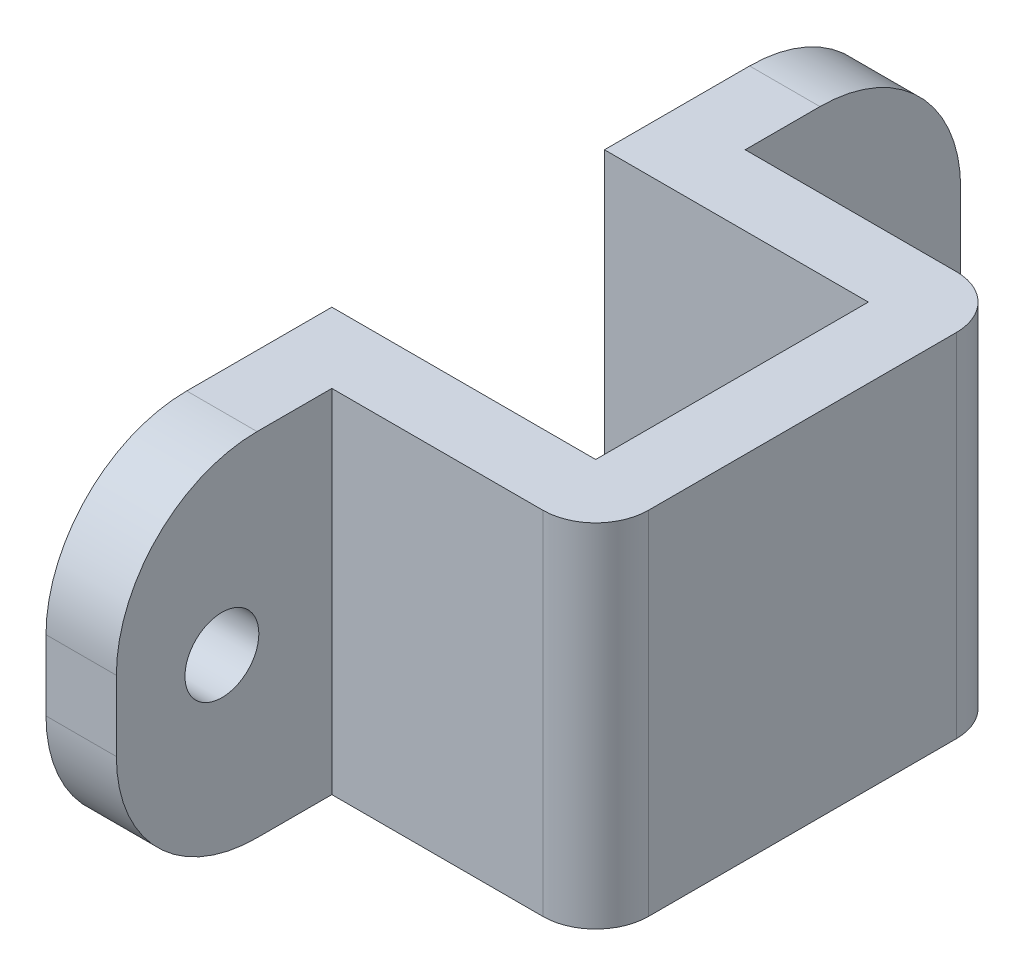
from build123d import *

# Parameters (mm, degrees)
EXTRUDE_1_DEPTH     = 20
SKETCH_3_R          = 2.1
CUT_EXTRUDE_1_DEPTH = 10
FILLET_1_R          = 8
FILLET_2_R          = 3


with BuildPart() as part:
    # 草图2 → 凸台-拉伸1 (new body)
    with BuildSketch(Plane(origin=(0, 0, 0), x_dir=(1, 0, 0), z_dir=(0, 1, 0))):
        Polygon((0, -7.75), (0, 7.75), (-11, 7.75), (-15, 7.75), (-15, 20), (-15, 24), (-11, 24), (-11, 20), (-11, 11.75), (-7, 11.75), (4, 11.75), (4, -11.75), (-7, -11.75), (-11, -11.75), (-11, -20), (-11, -24), (-15, -24), (-15, -20), (-15, -7.75), (-11, -7.75), align=None)
    extrude(amount=EXTRUDE_1_DEPTH)

    # 草图3 → 切除-拉伸1 (cut)
    with BuildSketch(Plane(origin=(-11, 0, 0), x_dir=(0, 0, -1), z_dir=(1, 0, 0))):
        with Locations((-18, 10)):
            Circle(SKETCH_3_R)
        with Locations((18, 10)):
            Circle(SKETCH_3_R)
    extrude(amount=-CUT_EXTRUDE_1_DEPTH, mode=Mode.SUBTRACT)

    # 圆角1
    fillet_1_edges = [part.edges().sort_by_distance(p)[0] for p in [
        (-13, 0, -24),
        (-13, 0, 24),
        (-13, 20, 24),
        (-13, 20, -24),
    ]]
    fillet(fillet_1_edges, radius=FILLET_1_R)

    # 圆角2
    fillet_2_edges = [part.edges().sort_by_distance(p)[0] for p in [
        (4, 10, -11.75),
        (4, 10, 11.75),
    ]]
    fillet(fillet_2_edges, radius=FILLET_2_R)


solid = part.part
